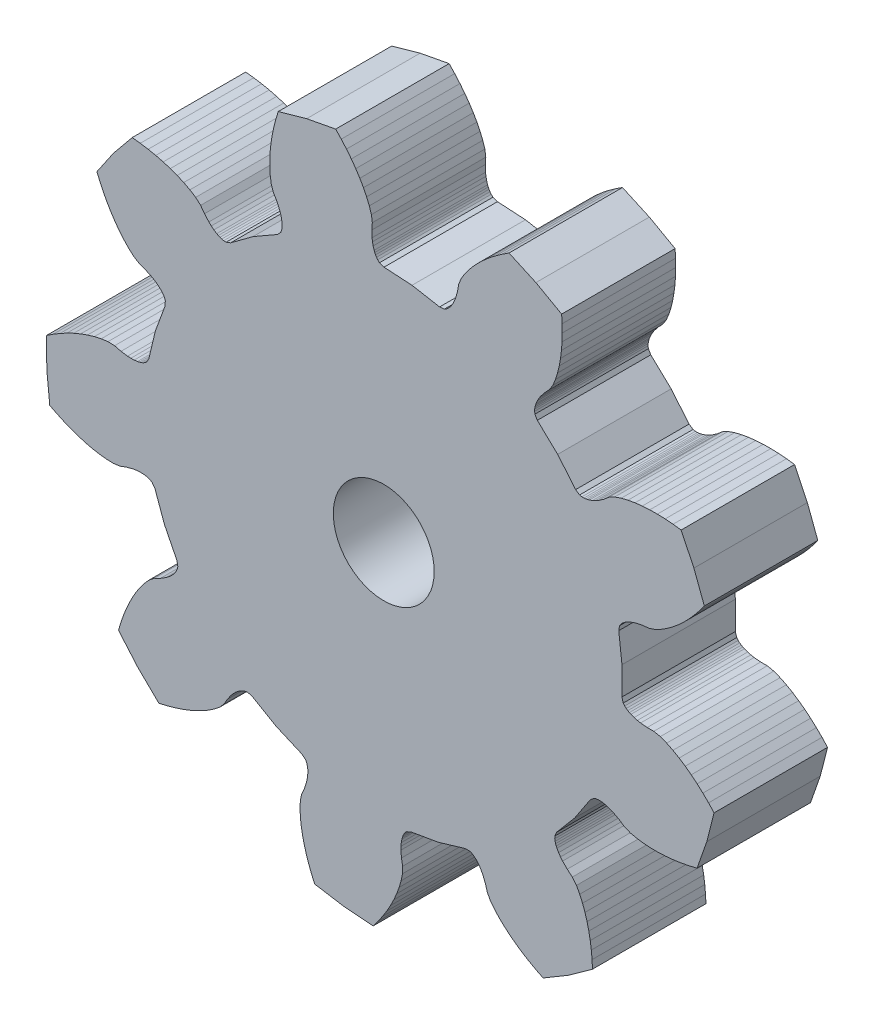
from build123d import *

# Parameters (mm, degrees)
SKETCH2_R           = 5.7785
BOSS_EXTRUDE2_DEPTH = 12.995349
SCALE1_SCALE        = 0.43


with BuildPart() as part:
    # Sketch2 → Boss-Extrude2 (new body)
    with BuildSketch(Plane.XY):
        Polygon((-34.274162162, -4.341986068), (-34.596488162, -3.900026068), (-34.829660162, -3.761850068), (-35.047084162, -3.677776068), (-35.256126162, -3.623674068), (-35.459834162, -3.589892068), (-35.659224162, -3.571350068), (-36.048860162, -3.568556068), (-36.429606162, -3.601576068), (-36.803240162, -3.662790068), (-37.533998162, -3.852274068), (-38.246722162, -4.115418068), (-38.996784162, -4.226670068), (-39.778342162, -4.207112068), (-40.574124162, -4.121514068), (-41.380320162, -3.979274068), (-42.194644162, -3.785218068), (-43.014810162, -3.542394068), (-43.839040162, -3.253088068), (-44.666064162, -2.918570068), (-45.493850162, -2.540110068), (-46.321382162, -2.118470068), (-46.657424162, 1.244743932), (-46.698318162, 4.624213932), (-45.923110162, 5.135515932), (-45.142568162, 5.603891932), (-44.357962162, 6.028579932), (-43.571070162, 6.408055932), (-42.783162162, 6.740541932), (-41.995508162, 7.024259932), (-41.210140162, 7.255399932), (-40.429090162, 7.429135932), (-39.654390162, 7.535815932), (-38.896454162, 7.508891932), (-38.159092162, 7.326773932), (-37.411824162, 7.219839932), (-37.033618162, 7.200789932), (-36.651602162, 7.210441932), (-36.264506162, 7.256415932), (-36.068418162, 7.297309932), (-35.870044162, 7.353443932), (-35.668114162, 7.430659932), (-35.461358162, 7.538355932), (-35.245204162, 7.701677932), (-34.974186162, 8.176911932), (-34.227934162, 11.301365932), (-33.120494162, 14.316599932), (-33.083156162, 14.862445932), (-33.172818162, 15.117969932), (-33.285594162, 15.322185932), (-33.411070162, 15.497953932), (-33.545182162, 15.654671932), (-33.685898162, 15.797165932), (-33.982824162, 16.049895932), (-34.295752162, 16.269097932), (-34.621126162, 16.462645932), (-35.302862162, 16.787257932), (-36.017872162, 17.043543932), (-36.664048162, 17.440545932), (-37.250280162, 17.957943932), (-37.804762162, 18.535031932), (-38.330796162, 19.162157932), (-38.829906162, 19.834241932), (-39.302092162, 20.547473932), (-39.747608162, 21.299059932), (-40.166200162, 22.086713932), (-40.557106162, 22.908911932), (-40.919818162, 23.763621932), (-39.015326162, 26.555843932), (-36.874360162, 29.171027932), (-35.952086162, 29.064601932), (-35.052926162, 28.921599932), (-34.179166162, 28.742529932), (-33.332330162, 28.527391932), (-32.514958162, 28.275677932), (-31.729336162, 27.986879932), (-30.979020162, 27.659219932), (-30.268836162, 27.290157932), (-29.606912162, 26.873851932), (-29.043794162, 26.366105932), (-28.595992162, 25.752441932), (-28.092056162, 25.190339932), (-27.814688162, 24.932529932), (-27.515730162, 24.694531932), (-27.189848162, 24.480917932), (-27.013318162, 24.385921932), (-26.825104162, 24.301593932), (-26.620888162, 24.230981932), (-26.393304162, 24.180435932), (-26.122794162, 24.166719932), (-25.609714162, 24.356457932), (-23.029836162, 26.270347932), (-20.243202162, 27.868261932), (-19.863726162, 28.262469932), (-19.768222162, 28.515961932), (-19.723264162, 28.744815932), (-19.706246162, 28.959953932), (-19.708278162, 29.166455932), (-19.724534162, 29.366099932), (-19.789812162, 29.750401932), (-19.888364162, 30.119463932), (-20.013332162, 30.476841932), (-20.326768162, 31.163657932), (-20.709800162, 31.819739932), (-20.949576162, 32.539067932), (-21.066162162, 33.312243932), (-21.120010162, 34.110819932), (-21.119756162, 34.929461932), (-21.070226162, 35.764867932), (-20.973452162, 36.614751932), (-20.831720162, 37.476827932), (-20.645792162, 38.349317932), (-20.416938162, 39.230443932), (-20.145158162, 40.118427932), (-16.891672162, 41.033335932), (-13.570622162, 41.660461932), (-12.932320162, 40.985837932), (-12.335420162, 40.298513932), (-11.781192162, 39.599759932), (-11.270906162, 38.890591932), (-10.806340162, 38.172279932), (-10.390288162, 37.446093932), (-10.026306162, 36.712795932), (-9.719474162, 35.973655932), (-9.479952162, 35.229181932), (-9.374796162, 34.478103932), (-9.426104162, 33.720421932), (-9.401720162, 32.965787932), (-9.354730162, 32.590121932), (-9.279038162, 32.215471932), (-9.166516162, 31.842345932), (-9.092348162, 31.656417932), (-9.002432162, 31.470489932), (-8.891434162, 31.285323932), (-8.749448162, 31.100411932), (-8.551074162, 30.915753932), (-8.035962162, 30.731349932), (-4.829466162, 30.539071932), (-1.667674162, 29.971889932), (-1.123606162, 30.030055932), (-0.887386162, 30.162897932), (-0.706030162, 30.309201932), (-0.554646162, 30.463379932), (-0.423582162, 30.622637932), (-0.307758162, 30.785959932), (-0.110654162, 31.122255932), (0.051143838, 31.468457932), (0.185255838, 31.822533932), (0.386423838, 32.550243932), (0.514693838, 33.299035932), (0.793585838, 34.004139932), (1.201255838, 34.671397932), (1.673187838, 35.317573932), (2.199475838, 35.944699932), (2.774785838, 36.552775932), (3.395053838, 37.141801932), (4.057739838, 37.711015932), (4.761065838, 38.259909932), (5.502745838, 38.787721932), (6.281509838, 39.293181932), (9.362021838, 37.902785932), (12.309437838, 36.248483932), (12.364555838, 35.321383932), (12.380049838, 34.411301932), (12.355411838, 33.519507932), (12.290641838, 32.648287932), (12.184723838, 31.799673932), (12.036387838, 30.975697932), (11.844109838, 30.179915932), (11.603825838, 29.416645932), (11.308931838, 28.692491932), (10.906595838, 28.049617932), (10.380307838, 27.501993932), (9.913963838, 26.908395932), (9.708477838, 26.590387932), (9.525851838, 26.254599932), (9.372181838, 25.896459932), (9.309443838, 25.706213932), (9.258897838, 25.506061932), (9.224607838, 25.292955932), (9.214701838, 25.060037932), (9.247975838, 24.791051932), (9.523819838, 24.318611932), (11.856809838, 22.110335932), (13.914209838, 19.643487932), (14.368361838, 19.338433932), (14.634553838, 19.288141932), (14.867725838, 19.283823932), (15.082609838, 19.304397932), (15.285555838, 19.342243932), (15.479357838, 19.393043932), (15.846387838, 19.523853932), (16.192843838, 19.685143932), (16.523297838, 19.870309932), (17.145089838, 20.298299932), (17.724463838, 20.789281932), (18.391467838, 21.150215932), (19.132639838, 21.399389932), (19.909625838, 21.590905932), (20.715821838, 21.733145932), (21.547417838, 21.829157932), (22.401111838, 21.881735932), (23.274871838, 21.891641932), (24.166157838, 21.860145932), (25.073699838, 21.787755932), (25.995465838, 21.674471932), (27.461299838, 18.629011932), (28.655607838, 15.467219932), (28.102141838, 14.721729932), (27.528863838, 14.014593932), (26.936789838, 13.347335932), (26.327189838, 12.721479932), (25.700317838, 12.139565932), (25.057443838, 11.603625932), (24.398567838, 11.117723932), (23.723943838, 10.687193932), (23.032301838, 10.322195932), (22.310941838, 10.088261932), (21.555799838, 10.007235932), (20.816913838, 9.852041932), (20.455217838, 9.740535932), (20.099363838, 9.600835932), (19.751383838, 9.425321932), (19.581203838, 9.319911932), (19.413817838, 9.199007932), (19.250495838, 9.057529932), (19.093015838, 8.885825932), (18.945949838, 8.658241932), (18.853493838, 8.118999932), (19.221031838, 4.927743932), (19.211633838, 1.715659932), (19.363271838, 1.190133932), (19.535229838, 0.980329932), (19.710743838, 0.827167932), (19.888797838, 0.704739932), (20.068375838, 0.603393932), (20.249477838, 0.517541932), (20.614983838, 0.381905932), (20.983791838, 0.282591932), (21.355901838, 0.212233932), (22.107487838, 0.140351932), (22.866947838, 0.144161932), (23.609897838, -0.007984068), (24.337861838, -0.293734068), (25.056173838, -0.646286068), (25.765087838, -1.055734068), (26.463841838, -1.516490068), (27.151673838, -2.025252068), (27.827313838, -2.578972068), (28.489999838, -3.176126068), (29.138461838, -3.814936068), (29.771683838, -4.494386068), (28.937293838, -7.769462068), (27.819947838, -10.959194068), (26.916469838, -11.174586068), (26.022897838, -11.347814068), (25.140501838, -11.478370068), (24.271059838, -11.565746068), (23.416857838, -11.608926068), (22.579927838, -11.606132068), (21.762809838, -11.554824068), (20.969313838, -11.450684068), (20.205027838, -11.286092068), (19.501955838, -11.001612068), (18.871273838, -10.578194068), (18.205539838, -10.222086068), (17.856797838, -10.075020068), (17.494593838, -9.953354068), (17.115117838, -9.864200068), (16.916743838, -9.835244068), (16.711003838, -9.820512068), (16.495103838, -9.823814068), (16.263963838, -9.854294068), (16.004883838, -9.933796068), (15.587561838, -10.287618068), (13.817943838, -12.968334068), (11.745811838, -15.422990068), (11.524323838, -15.923370068), (11.521021838, -16.194134068), (11.557089838, -16.424512068), (11.614747838, -16.632792068), (11.687137838, -16.825832068), (11.770957838, -17.007950068), (11.963489838, -17.346786068), (12.182437838, -17.659968068), (12.422213838, -17.953084068), (12.951549838, -18.491056068), (13.535749838, -18.976704068), (14.007173838, -19.570556068), (14.381061838, -20.257372068), (14.704911838, -20.989146068), (14.984819838, -21.758512068), (15.223833838, -22.560644068), (15.423731838, -23.392494068), (15.585275838, -24.251014068), (15.708973838, -25.134426068), (15.795079838, -26.040698068), (15.843593838, -26.968052068), (13.099123838, -28.940616068), (10.192855838, -30.665784068), (9.362529838, -30.249986068), (8.566493838, -29.808280068), (7.806525838, -29.341174068), (7.084657838, -28.849430068), (6.402413838, -28.333302068), (5.763095838, -27.793044068), (5.170259838, -27.228656068), (4.628985838, -26.638868068), (4.149433838, -26.021394068), (3.793833838, -25.351596068), (3.582759838, -24.621854068), (3.301835838, -23.921322068), (3.129115838, -23.584264068), (2.929725838, -23.258128068), (2.696299838, -22.945962068), (2.563203838, -22.796610068), (2.415121838, -22.652846068), (2.247481838, -22.516702068), (2.050885838, -22.391480068), (1.801203838, -22.285816068), (1.254087838, -22.288610068), (-1.824646162, -23.204788068), (-4.989740162, -23.753174068), (-5.480976162, -23.993966068), (-5.657760162, -24.199452068), (-5.778156162, -24.399096068), (-5.867818162, -24.595438068), (-5.936398162, -24.790002068), (-5.989484162, -24.983296068), (-6.059588162, -25.366582068), (-6.093116162, -25.747328068), (-6.097942162, -26.126042068), (-6.038252162, -26.878390068), (-5.902870162, -27.625912068), (-5.923444162, -28.383848068), (-6.078384162, -29.150420068), (-6.300888162, -29.919024068), (-6.581050162, -30.688390068), (-6.913536162, -31.456486068), (-7.295044162, -32.222042068), (-7.723034162, -32.983788068), (-8.196236162, -33.739946068), (-8.712618162, -34.489500068), (-9.271672162, -35.231180068), (-12.641998162, -34.978196068), (-15.977272162, -34.431588068), (-16.346080162, -33.579418068), (-16.671962162, -32.729280068), (-16.953902162, -31.882952068), (-17.190884162, -31.042212068), (-17.381638162, -30.208330068), (-17.524132162, -29.383592068), (-17.615572162, -28.570030068), (-17.650878162, -27.770438068), (-17.621414162, -26.989134068), (-17.463426162, -26.247454068), (-17.155832162, -25.552764068), (-16.920882162, -24.835468068), (-16.836554162, -24.466152068), (-16.779658162, -24.088454068), (-16.757814162, -23.699326068), (-16.763910162, -23.498920068), (-16.784738162, -23.293688068), (-16.825632162, -23.081598068), (-16.895736162, -22.859348068), (-17.019180162, -22.618048068), (-17.440058162, -22.268544068), (-20.387474162, -20.991178068), (-23.164456162, -19.376754068), (-23.695570162, -19.245436068), (-23.963032162, -19.289378068), (-24.183504162, -19.364816068), (-24.378576162, -19.457780068), (-24.556122162, -19.562682068), (-24.720968162, -19.676728068), (-25.021196162, -19.925394068), (-25.291706162, -20.195142068), (-25.538594162, -20.482162068), (-25.976490162, -21.097096068), (-26.353172162, -21.756734068), (-26.856346162, -22.324170068), (-27.467724162, -22.811596068), (-28.132442162, -23.257620068), (-28.841356162, -23.666814068), (-29.589894162, -24.041464068), (-30.374246162, -24.382840068), (-31.191618162, -24.690942068), (-32.040232162, -24.966278068), (-32.917548162, -25.208340068), (-33.822550162, -25.417128068), (-36.241646162, -23.056960068), (-38.445350162, -20.494354068), (-38.180174162, -19.604592068), (-37.883248162, -18.743786068), (-37.555334162, -17.914476068), (-37.196432162, -17.117932068), (-36.806542162, -16.356440068), (-36.385410162, -15.633048068), (-35.932528162, -14.951058068), (-35.445864162, -14.315804068), (-34.920846162, -13.736430068), (-34.323184162, -13.269832068), (-33.641194162, -12.935314068), (-32.999844162, -12.536788068), (-32.698092162, -12.308188068), (-32.411580162, -12.055458068), (-32.144626162, -11.771232068), (-32.020674162, -11.614006068), (-31.904596162, -11.443318068), (-31.799694162, -11.254596068), (-31.710540162, -11.039204068), (-31.649834162, -10.775044068), (-31.747624162, -10.236818068), (-33.184502162, -7.363824068), align=None)
        with Locations((-8.065426162, 3.402219932)):
            Circle(SKETCH2_R, mode=Mode.SUBTRACT)
    extrude(amount=BOSS_EXTRUDE2_DEPTH)


with BuildPart() as part_1:
    # Scale1: scaled about (-8.065336084, 3.40230384, 6.4976745)
    add(part.part.scale(SCALE1_SCALE).moved(Location((-4.597241568, 1.939313189, 3.703674465))))


solid = part_1.part
